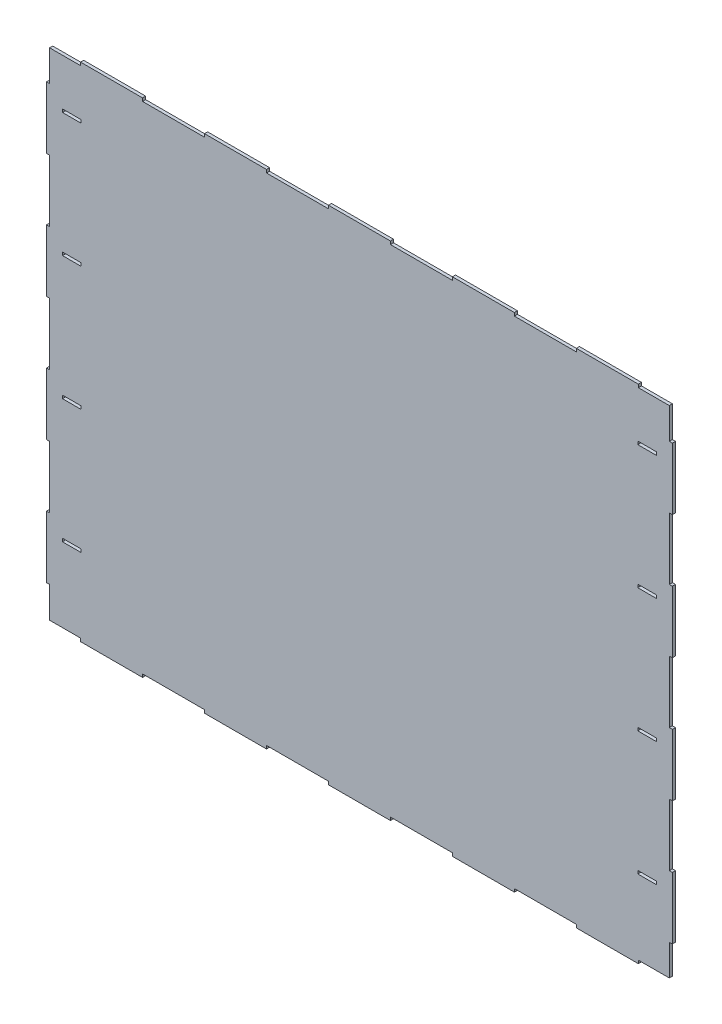
from build123d import *

# Parameters (mm, degrees)
SKETCH1_W               = 15
SKETCH1_H               = 2.5
F_50X40_TOP_PLANE_DEPTH = 2.5


with BuildPart() as part:
    # Sketch1 → 50X40 top plane (new body)
    with BuildSketch(Plane.XY):
        Polygon((86.520385927, 37.146891895), (86.520385927, 39.646891895), (136.520385927, 39.646891895), (136.520385927, 37.146891895), (186.520385927, 37.146891895), (186.520385927, 39.646891895), (236.520385927, 39.646891895), (236.520385927, 37.146891895), (286.520385927, 37.146891895), (286.520385927, 39.646891895), (336.520385927, 39.646891895), (336.520385927, 37.146891895), (386.520385927, 37.146891895), (386.520385927, 39.646891895), (436.520385927, 39.646891895), (436.520385927, 37.146891895), (461.520385927, 37.146891895), (461.520385927, 12.146891895), (464.020385927, 12.146891895), (464.020385927, -37.853108105), (461.520385927, -37.853108105), (461.520385927, -87.853108105), (464.020385927, -87.853108105), (464.020385927, -137.853108105), (461.520385927, -137.853108105), (461.520385927, -187.853108105), (464.020385927, -187.853108105), (464.020385927, -237.853108105), (461.520385927, -237.853108105), (461.520385927, -287.853108105), (464.020385927, -287.853108105), (464.020385927, -337.853108105), (461.520385927, -337.853108105), (461.520385927, -362.853108105), (436.520385927, -362.853108105), (436.520385927, -365.353108105), (386.520385927, -365.353108105), (386.520385927, -362.853108105), (336.520385927, -362.853108105), (336.520385927, -365.353108105), (286.520385927, -365.353108105), (286.520385927, -362.853108105), (236.520385927, -362.853108105), (236.520385927, -365.353108105), (186.520385927, -365.353108105), (186.520385927, -362.853108105), (136.520385927, -362.853108105), (136.520385927, -365.353108105), (86.520385927, -365.353108105), (86.520385927, -362.853108105), (36.520385927, -362.853108105), (36.520385927, -365.353108105), (-13.479614073, -365.353108105), (-13.479614073, -362.853108105), (-38.479614073, -362.853108105), (-38.479614073, -337.853108105), (-40.979614073, -337.853108105), (-40.979614073, -287.853108105), (-38.479614073, -287.853108105), (-38.479614073, -237.853108105), (-40.979614073, -237.853108105), (-40.979614073, -187.853108105), (-38.479614073, -187.853108105), (-38.479614073, -137.853108105), (-40.979614073, -137.853108105), (-40.979614073, -87.853108105), (-38.479614073, -87.853108105), (-38.479614073, -37.853108105), (-40.979614073, -37.853108105), (-40.979614073, 12.146891895), (-38.479614073, 12.146891895), (-38.479614073, 37.146891895), (-13.479614073, 37.146891895), (-13.479614073, 39.646891895), (36.520385927, 39.646891895), (36.520385927, 37.146891895), align=None)
        with Locations((443.61350048, -101.603108105)):
            Rectangle(SKETCH1_W, SKETCH1_H, mode=Mode.SUBTRACT)
        with Locations((443.61350048, -1.603108105)):
            Rectangle(SKETCH1_W, SKETCH1_H, mode=Mode.SUBTRACT)
        with Locations((443.61350048, -201.603108105)):
            Rectangle(SKETCH1_W, SKETCH1_H, mode=Mode.SUBTRACT)
        with Locations((443.61350048, -301.603108105)):
            Rectangle(SKETCH1_W, SKETCH1_H, mode=Mode.SUBTRACT)
        with Locations((-20.572728625, -301.603108105)):
            Rectangle(SKETCH1_W, SKETCH1_H, mode=Mode.SUBTRACT)
        with Locations((-20.572728625, -201.603108105)):
            Rectangle(SKETCH1_W, SKETCH1_H, mode=Mode.SUBTRACT)
        with Locations((-20.572728625, -101.603108105)):
            Rectangle(SKETCH1_W, SKETCH1_H, mode=Mode.SUBTRACT)
        with Locations((-20.572728625, -1.603108105)):
            Rectangle(SKETCH1_W, SKETCH1_H, mode=Mode.SUBTRACT)
    extrude(amount=F_50X40_TOP_PLANE_DEPTH)


solid = part.part
